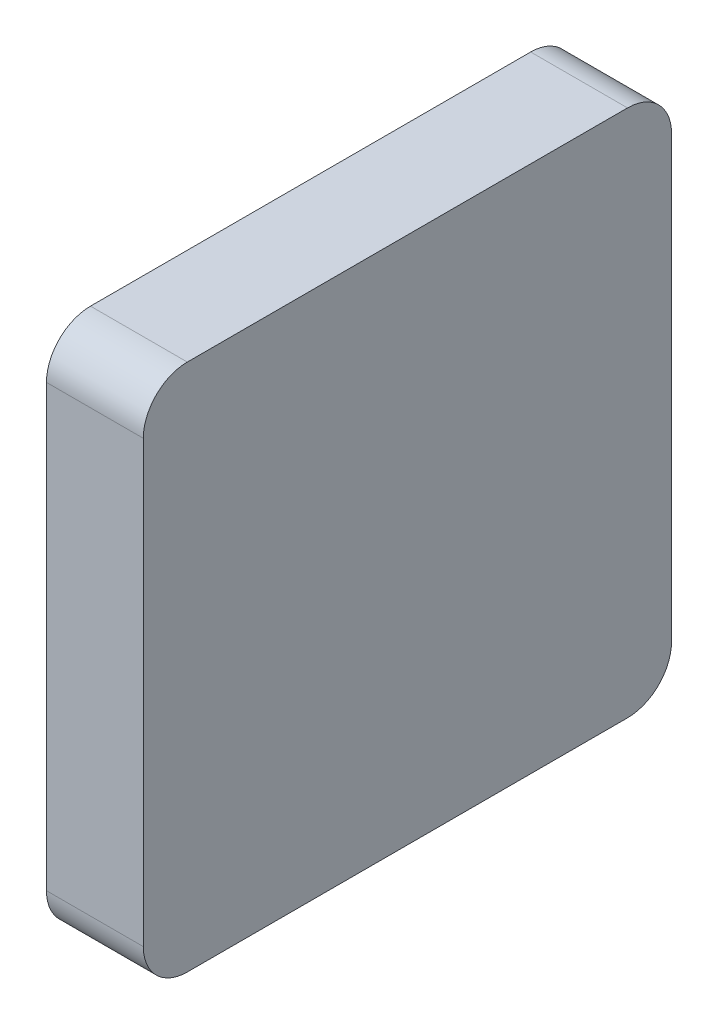
from build123d import *

# Parameters (mm, degrees)
SKETCH_1_W      = 120
SKETCH_1_H      = 120
EXTRUDE_1_DEPTH = 22
FILLET_1_R      = 10


with BuildPart() as part:
    # 草图1 → 凸台-拉伸1 (new body)
    with BuildSketch(Plane(origin=(0, 0, 0), x_dir=(0, 0, -1), z_dir=(1, 0, 0))):
        Rectangle(SKETCH_1_W, SKETCH_1_H)
    extrude(amount=EXTRUDE_1_DEPTH)

    # 圆角1
    fillet_1_edges = [part.edges().sort_by_distance(p)[0] for p in [
        (11, 60, 60),
        (11, 60, -60),
        (11, -60, -60),
        (11, -60, 60),
    ]]
    fillet(fillet_1_edges, radius=FILLET_1_R)


solid = part.part
